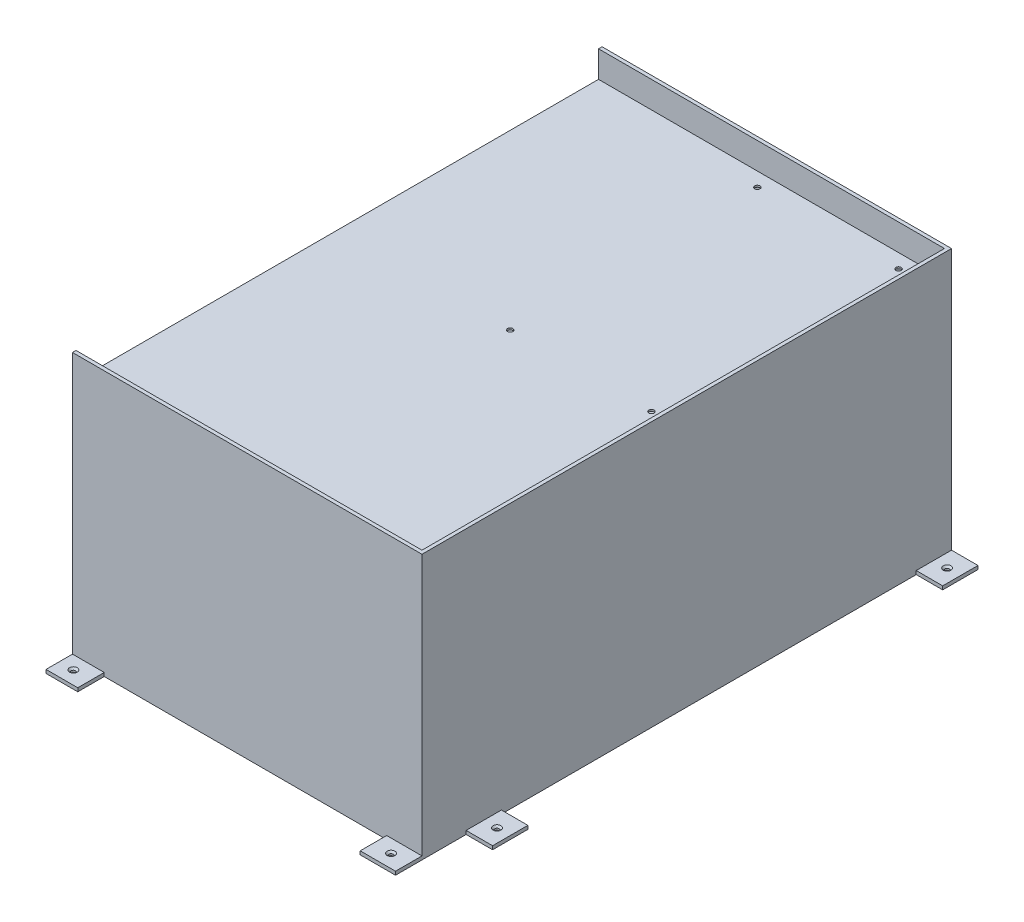
from build123d import *

# Parameters (mm, degrees)
SKETCH2_W                                           = 200
SKETCH2_H                                           = 300
BOSS_EXTRUDE1_DEPTH                                 = 150
SHELL1_T                                            = -2
SKETCH4_W                                           = 20
SKETCH4_H                                           = 15
SKETCH4_W_2                                         = 15
SKETCH4_H_2                                         = 20
BOSS_EXTRUDE2_DEPTH                                 = 2
CSK_FOR_M2_COUNTERSUNK_FLAT_HEAD_SCREW1_D           = 2.4
CSK_FOR_M2_COUNTERSUNK_FLAT_HEAD_SCREW1_DEPTH       = 30
CSK_FOR_M2_COUNTERSUNK_FLAT_HEAD_SCREW1_CSINK_D     = 4.4
CSK_FOR_M2_COUNTERSUNK_FLAT_HEAD_SCREW1_CSINK_ANGLE = 90
CSK_FOR_M2_COUNTERSUNK_FLAT_HEAD_SCREW1_TIP         = 0.721032743
SKETCH6_W                                           = 200
SKETCH6_H                                           = 1
EXTRUDE_THIN1_DEPTH                                 = 296
CUT_EXTRUDE1_DEPTH                                  = 2
F_3_0MM_DOWEL_HOLE1_D                               = 3
F_3_0MM_DOWEL_HOLE1_DEPTH                           = 30
F_3_0MM_DOWEL_HOLE1_TIP                             = 0.901290929


with BuildPart() as part:
    # Sketch2 → Boss-Extrude1 (new body)
    with BuildSketch(Plane(origin=(0, 0, 0), x_dir=(1, 0, 0), z_dir=(0, 1, 0))):
        Rectangle(SKETCH2_W, SKETCH2_H)
    extrude(amount=BOSS_EXTRUDE1_DEPTH)

    # Shell1
    shell1_openings = [part.faces().sort_by_distance(p)[0] for p in [
        (0, 150, 0),
    ]]
    offset(amount=SHELL1_T, openings=shell1_openings, kind=Kind.INTERSECTION)

    # Sketch4 → Boss-Extrude2 (add)
    with BuildSketch(Plane(origin=(0, 0, 0), x_dir=(1, 0, 0), z_dir=(0, 1, 0))):
        with Locations((-90, -157.5)):
            Rectangle(SKETCH4_W, SKETCH4_H)
        with Locations((90, -157.5)):
            Rectangle(SKETCH4_W, SKETCH4_H)
        with Locations((107.5, 140)):
            Rectangle(SKETCH4_W_2, SKETCH4_H_2)
        with Locations((107.5, -115)):
            Rectangle(SKETCH4_W_2, SKETCH4_H_2)
    extrude(amount=BOSS_EXTRUDE2_DEPTH)

    # CSK for M2 Countersunk Flat Head Screw1
    with Locations(Plane(origin=(107.5, 2, -140), x_dir=(0, 0, 1), z_dir=(0, 1, 0))):
        with Locations((0, 0), (255, 0), (297.5, -17.5), (297.5, -197.5)):
            CounterSinkHole(CSK_FOR_M2_COUNTERSUNK_FLAT_HEAD_SCREW1_D / 2, CSK_FOR_M2_COUNTERSUNK_FLAT_HEAD_SCREW1_CSINK_D / 2, depth=CSK_FOR_M2_COUNTERSUNK_FLAT_HEAD_SCREW1_DEPTH, counter_sink_angle=CSK_FOR_M2_COUNTERSUNK_FLAT_HEAD_SCREW1_CSINK_ANGLE)
            with Locations((0, 0, -(CSK_FOR_M2_COUNTERSUNK_FLAT_HEAD_SCREW1_DEPTH + CSK_FOR_M2_COUNTERSUNK_FLAT_HEAD_SCREW1_TIP / 2))):  # 118° drill point
                Cone(0, CSK_FOR_M2_COUNTERSUNK_FLAT_HEAD_SCREW1_D / 2, CSK_FOR_M2_COUNTERSUNK_FLAT_HEAD_SCREW1_TIP, mode=Mode.SUBTRACT)

    # Sketch6 → Extrude-Thin1 (add)
    with BuildSketch(Plane(origin=(0, 0, 148), x_dir=(-1, 0, 0), z_dir=(0, 0, -1))):
        with Locations((0, 44.5)):
            Rectangle(SKETCH6_W, SKETCH6_H)
        with Locations((0, 89.5)):
            Rectangle(SKETCH6_W, SKETCH6_H)
        with Locations((0, 134.5)):
            Rectangle(SKETCH6_W, SKETCH6_H)
    extrude(amount=EXTRUDE_THIN1_DEPTH)

    # Sketch7 → Cut-Extrude1 (cut)
    with BuildSketch(Plane.ZY.offset(100)):
        Polygon((-150, 0), (165, 0), (165, 2), (150, 2), (150, 150), (-150, 150), align=None)
    extrude(amount=-CUT_EXTRUDE1_DEPTH, mode=Mode.SUBTRACT)

    # Ø3.0mm Dowel Hole1
    with Locations(Plane(origin=(0, 135, 0), x_dir=(1, 0, 0), z_dir=(0, 1, 0))):
        with Locations((0, 0), (80, 140), (0, 140), (80, 0)):
            Hole(F_3_0MM_DOWEL_HOLE1_D / 2, depth=F_3_0MM_DOWEL_HOLE1_DEPTH)
            with Locations((0, 0, -(F_3_0MM_DOWEL_HOLE1_DEPTH + F_3_0MM_DOWEL_HOLE1_TIP / 2))):  # 118° drill point
                Cone(0, F_3_0MM_DOWEL_HOLE1_D / 2, F_3_0MM_DOWEL_HOLE1_TIP, mode=Mode.SUBTRACT)


solid = part.part
